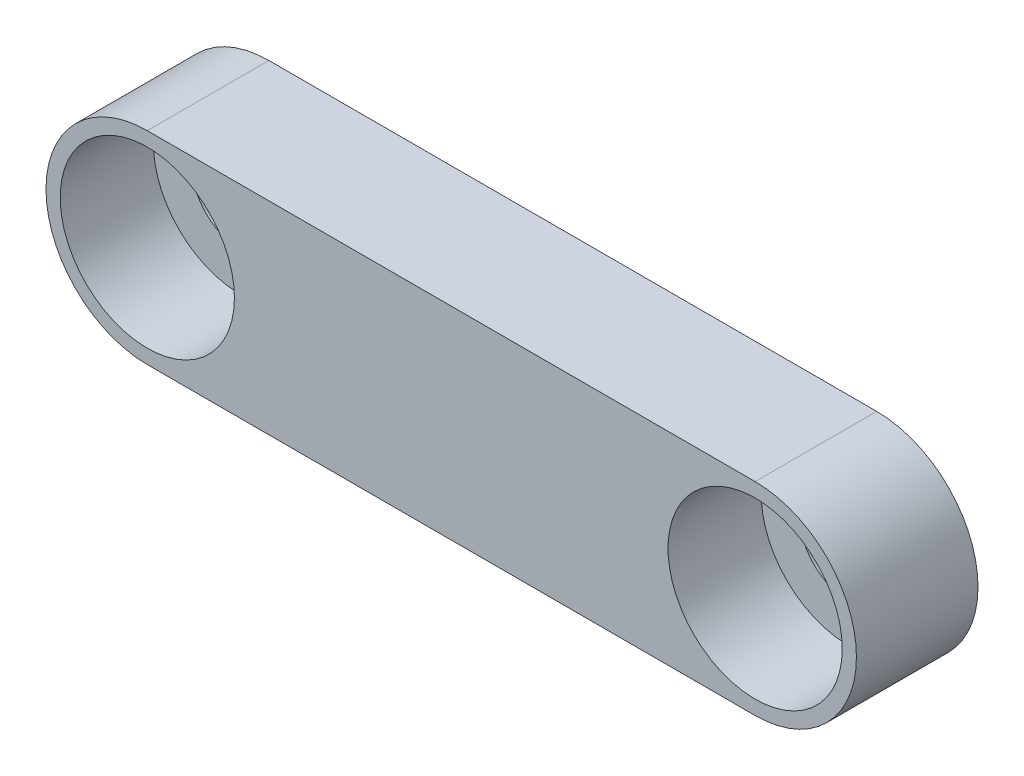
from build123d import *

# Parameters (mm, degrees)
EXTRUDE_1_DEPTH           = 3
HOLE_WIZARD_1_D           = 2.4
HOLE_WIZARD_1_DEPTH       = 5.2
HOLE_WIZARD_1_CBORE_D     = 4.3
HOLE_WIZARD_1_CBORE_DEPTH = 2.3
HOLE_WIZARD_1_TIP         = 0.721032743


with BuildPart() as part:
    # 草图1 → 凸台-拉伸1 (new body)
    with BuildSketch(Plane.XY):
        with BuildLine():
            Line((-7.5, 2.5), (7.5, 2.5))
            ThreePointArc((7.5, 2.5), (10, 0), (7.5, -2.5))
            Line((7.5, -2.5), (-7.5, -2.5))
            ThreePointArc((-7.5, -2.5), (-10, 0), (-7.5, 2.5))
        make_face()
    extrude(amount=EXTRUDE_1_DEPTH)

    # 打孔尺寸(%根据)内六角圆柱头螺钉的类型1
    with Locations(Plane.XY.offset(3)):
        with Locations((-7.5, 0), (7.5, 0)):
            CounterBoreHole(HOLE_WIZARD_1_D / 2, HOLE_WIZARD_1_CBORE_D / 2, HOLE_WIZARD_1_CBORE_DEPTH, depth=HOLE_WIZARD_1_DEPTH)
            with Locations((0, 0, -(HOLE_WIZARD_1_DEPTH + HOLE_WIZARD_1_TIP / 2))):  # 118° drill point
                Cone(0, HOLE_WIZARD_1_D / 2, HOLE_WIZARD_1_TIP, mode=Mode.SUBTRACT)


solid = part.part
